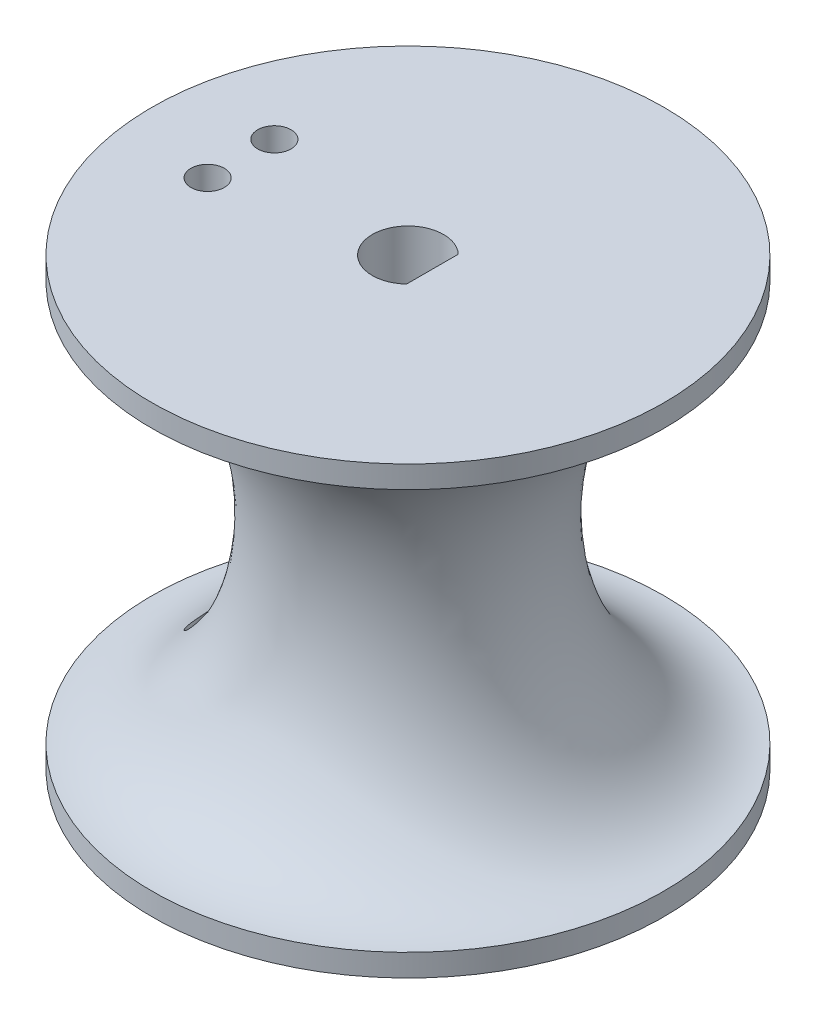
from build123d import *

# Parameters (mm, degrees)
SKETCH8_RX         = 18
SKETCH8_RY         = 12
SKETCH1_R          = 1.5
CUT_EXTRUDE1_DEPTH = 52.555795108


with BuildPart() as part:
    # Sketch4 → Revolve1 (revolve)
    with BuildSketch(Plane.XY, mode=Mode.PRIVATE) as revolve1_sk:
        Polygon((-23, 0), (0, 0), (0, 40), (-23, 40), (-23, 35), (-23, 5), align=None)
    revolve(revolve1_sk.sketch.rotate(Axis((0, -1.5, 0), (0, 1, 0)), 270), axis=Axis((0, -1.5, 0), (0, 1, 0)))

    # Sketch8 → Cut-Revolve2 (revolve, cut)
    with BuildSketch(Plane.XY, mode=Mode.PRIVATE) as cut_revolve2_sk:
        with Locations(Location((-23, 20), (0, 0, 90))):
            Ellipse(SKETCH8_RX, SKETCH8_RY)
    revolve(cut_revolve2_sk.sketch.rotate(Axis((0, -1.5, 0), (0, 1, 0)), 270), axis=Axis((0, -1.5, 0), (0, 1, 0)), mode=Mode.SUBTRACT)

    # Sketch1 → Cut-Extrude1 (cut, through all)
    with BuildSketch(Plane(origin=(0, 0, 0), x_dir=(-1, 0, 0), z_dir=(0, -1, 0))):
        with Locations(Location((15, 3, 0), (0, 0, 90))):
            Circle(SKETCH1_R)
        with Locations(Location((15, -3, 0), (0, 0, 90))):
            Circle(SKETCH1_R)
        with BuildLine():
            Line((-2.2, 2.323790008), (-2.2, -2.323790008))
            ThreePointArc((-2.2, -2.323790008), (3.2, 0), (-2.2, 2.323790008))
        make_face()
    extrude(amount=-CUT_EXTRUDE1_DEPTH, mode=Mode.SUBTRACT)


solid = part.part
